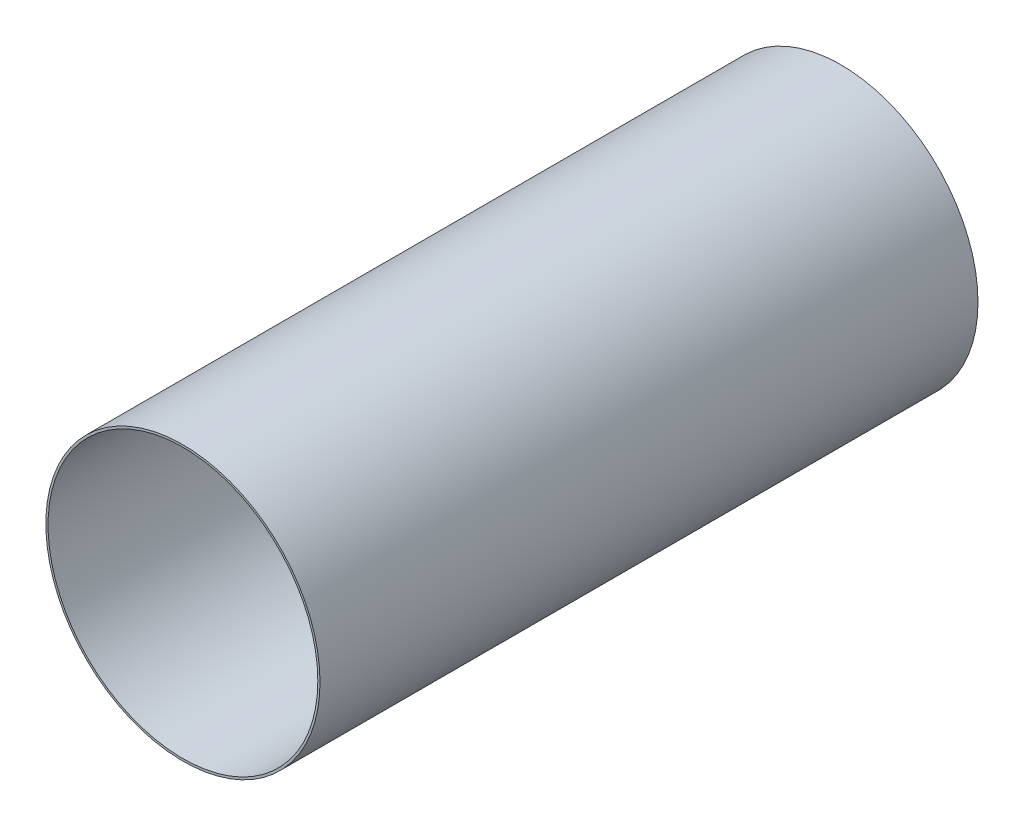
from build123d import *

# Parameters (mm, degrees)
SKETCH1_R           = 62.5
SKETCH1_R_2         = 61.5
BOSS_EXTRUDE1_DEPTH = 150


with BuildPart() as part:
    # Sketch1 → Boss-Extrude1 (new, symmetric)
    with BuildSketch(Plane.XY):
        Circle(SKETCH1_R)
        Circle(SKETCH1_R_2, mode=Mode.SUBTRACT)
    extrude(amount=BOSS_EXTRUDE1_DEPTH, both=True)


solid = part.part
